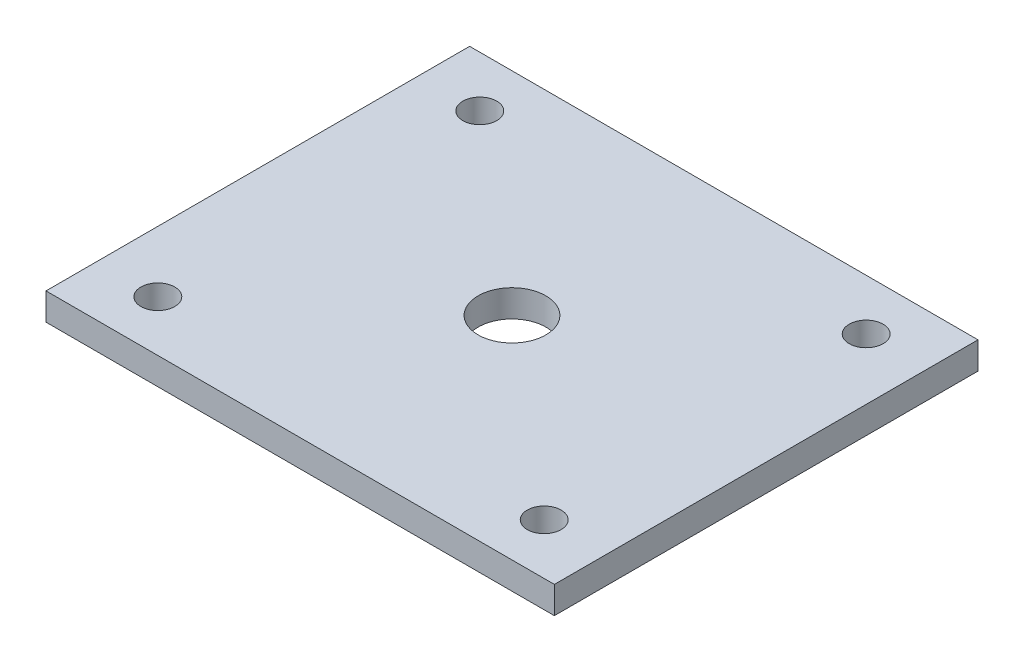
from build123d import *

# Parameters (mm, degrees)
SKETCH2_W           = 30
SKETCH2_H           = 25
SKETCH2_R           = 1
SKETCH2_R_2         = 2
BOSS_EXTRUDE1_DEPTH = 1.6


with BuildPart() as part:
    # Sketch2 → Boss-Extrude1 (new body)
    with BuildSketch(Plane(origin=(0, 0, 0), x_dir=(1, 0, 0), z_dir=(0, 1, 0))):
        Rectangle(SKETCH2_W, SKETCH2_H)
        with Locations(Location((-11.4, 9.5, 0), (0, 0, 270))):
            Circle(SKETCH2_R, mode=Mode.SUBTRACT)
        with Locations(Location((11.4, 9.5, 0), (0, 0, 270))):
            Circle(SKETCH2_R, mode=Mode.SUBTRACT)
        with Locations(Location((11.4, -9.5, 0), (0, 0, 90))):
            Circle(SKETCH2_R, mode=Mode.SUBTRACT)
        with Locations(Location((-11.4, -9.5, 0), (0, 0, 90))):
            Circle(SKETCH2_R, mode=Mode.SUBTRACT)
        with Locations(Location((0, 0, 0), (0, 0, 270))):
            Circle(SKETCH2_R_2, mode=Mode.SUBTRACT)
    extrude(amount=BOSS_EXTRUDE1_DEPTH)


solid = part.part
